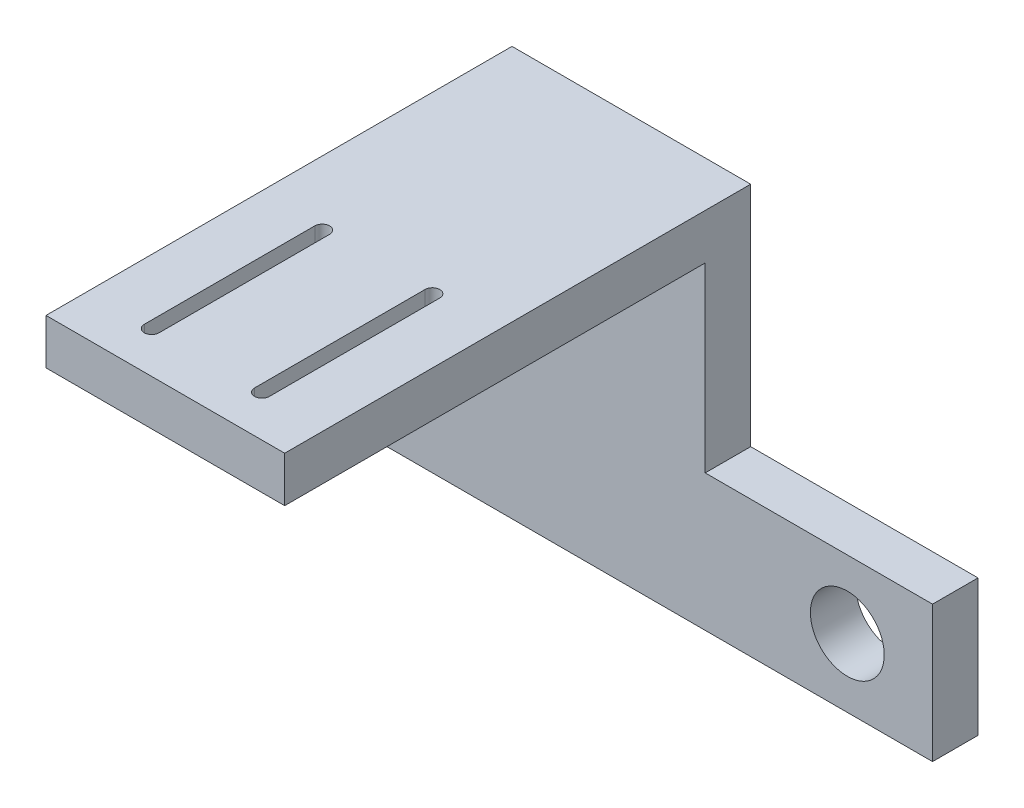
from build123d import *

# Parameters (mm, degrees)
SKETCH1_W           = 61
SKETCH1_H           = 12
SKETCH1_R           = 3.25
BOSS_EXTRUDE1_DEPTH = 4
BOSS_EXTRUDE2_START = -20
BOSS_EXTRUDE2_DEPTH = 21
CUT_EXTRUDE1_REACH  = 82.162


with BuildPart() as part:
    # Sketch1 → Boss-Extrude1 (new body)
    with BuildSketch(Plane.XY):
        with Locations((30.5, 6)):
            Rectangle(SKETCH1_W, SKETCH1_H)
        with Locations((7.5, 6)):
            Circle(SKETCH1_R, mode=Mode.SUBTRACT)
        with Locations((53.5, 6)):
            Circle(SKETCH1_R, mode=Mode.SUBTRACT)
    extrude(amount=BOSS_EXTRUDE1_DEPTH)

    # Sketch3 → Boss-Extrude2 (add)
    with BuildSketch(Plane.ZY.offset(BOSS_EXTRUDE2_START)):
        Polygon((4, 12), (4, 28), (41, 28), (41, 32), (0, 32), (0, 12), align=None)
    extrude(amount=-BOSS_EXTRUDE2_DEPTH)

    # Sketch4 → Cut-Extrude1 (cut, up to next)
    with BuildSketch(Plane(origin=(0, 32, 0), x_dir=(1, 0, 0), z_dir=(0, 1, 0)), mode=Mode.PRIVATE) as cut_extrude1_sk1:
        with BuildLine():
            Line((36, -22.35), (36, -37.35))
            ThreePointArc((36, -37.35), (35.35, -38), (34.7, -37.35))
            Line((34.7, -37.35), (34.7, -22.35))
            ThreePointArc((34.7, -22.35), (35.35, -21.7), (36, -22.35))
        make_face()
    cut_extrude1_tool1 = extrude(cut_extrude1_sk1.sketch, amount=-CUT_EXTRUDE1_REACH, mode=Mode.PRIVATE) & part.part
    # Sketch4 → Cut-Extrude1 (cut, up to next)
    with BuildSketch(Plane(origin=(0, 32, 0), x_dir=(1, 0, 0), z_dir=(0, 1, 0)), mode=Mode.PRIVATE) as cut_extrude1_sk2:
        with BuildLine():
            Line((26.3, -22.35), (26.3, -37.35))
            ThreePointArc((26.3, -37.35), (25.65, -38), (25, -37.35))
            Line((25, -37.35), (25, -22.35))
            ThreePointArc((25, -22.35), (25.65, -21.7), (26.3, -22.35))
        make_face()
    cut_extrude1_tool2 = extrude(cut_extrude1_sk2.sketch, amount=-CUT_EXTRUDE1_REACH, mode=Mode.PRIVATE) & part.part
    add(cut_extrude1_tool1.solids().sort_by_distance((35.35, 32, 29.85))[0], mode=Mode.SUBTRACT)
    add(cut_extrude1_tool2.solids().sort_by_distance((25.65, 32, 29.85))[0], mode=Mode.SUBTRACT)


solid = part.part
